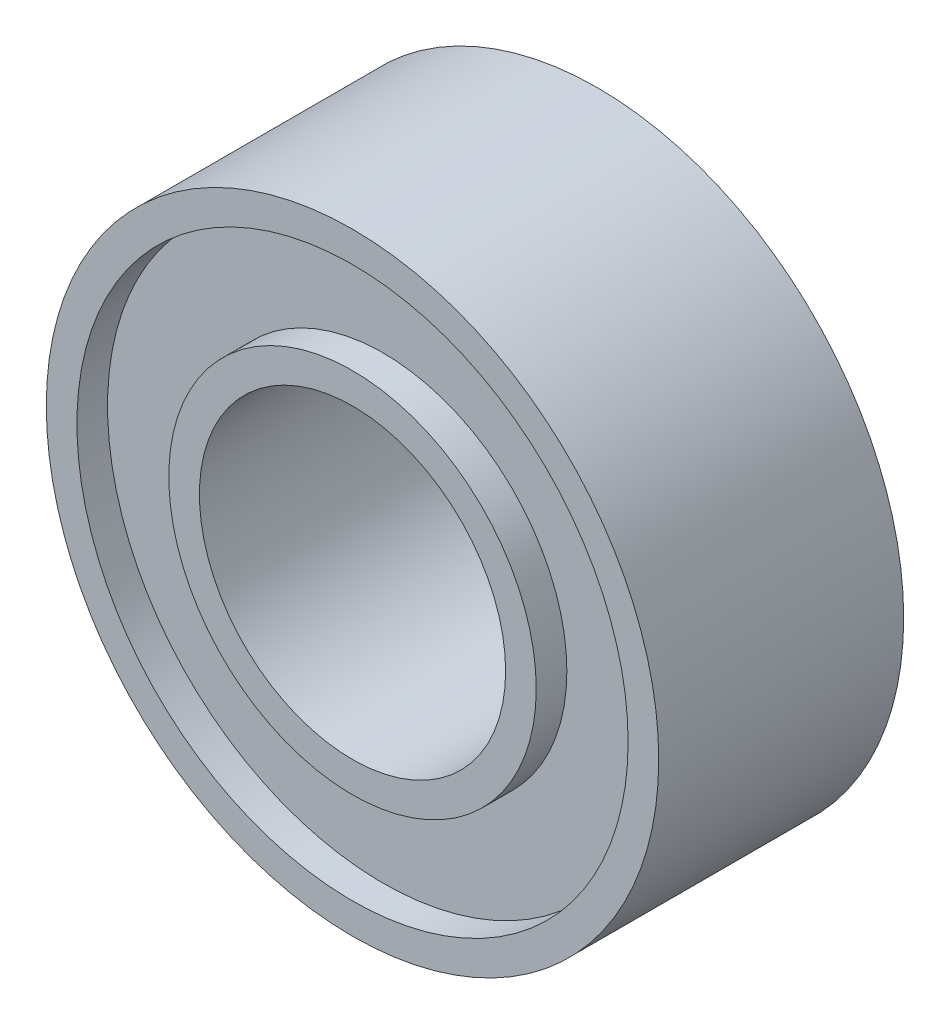
from build123d import *

# Parameters (mm, degrees)
SKETCH_2_R          = 5
SKETCH_2_R_2        = 2.5
EXTRUDE_1_DEPTH     = 4
SKETCH_3_R          = 4.5
SKETCH_3_R_2        = 3
CUT_EXTRUDE_1_DEPTH = 0.5
CUT_EXTRUDE_START   = -3.5
SKETCH_3_2_R        = 4.5
SKETCH_3_2_R_2      = 3
CUT_EXTRUDE_2_DEPTH = 0.5


with BuildPart() as part:
    # 草图2 → 凸台-拉伸1 (new body)
    with BuildSketch(Plane.XY):
        Circle(SKETCH_2_R)
        Circle(SKETCH_2_R_2, mode=Mode.SUBTRACT)
    extrude(amount=EXTRUDE_1_DEPTH)

    # 草图3 → 切除-拉伸1 (cut)
    with BuildSketch(Plane.XY.offset(4)):
        Circle(SKETCH_3_R)
        Circle(SKETCH_3_R_2, mode=Mode.SUBTRACT)
    extrude(amount=-CUT_EXTRUDE_1_DEPTH, mode=Mode.SUBTRACT)

    # 草图3<2> → 切除-拉伸2 (cut)
    with BuildSketch(Plane.XY.offset(4).offset(CUT_EXTRUDE_START)):
        Circle(SKETCH_3_2_R)
        Circle(SKETCH_3_2_R_2, mode=Mode.SUBTRACT)
    extrude(amount=-CUT_EXTRUDE_2_DEPTH, mode=Mode.SUBTRACT)


solid = part.part
